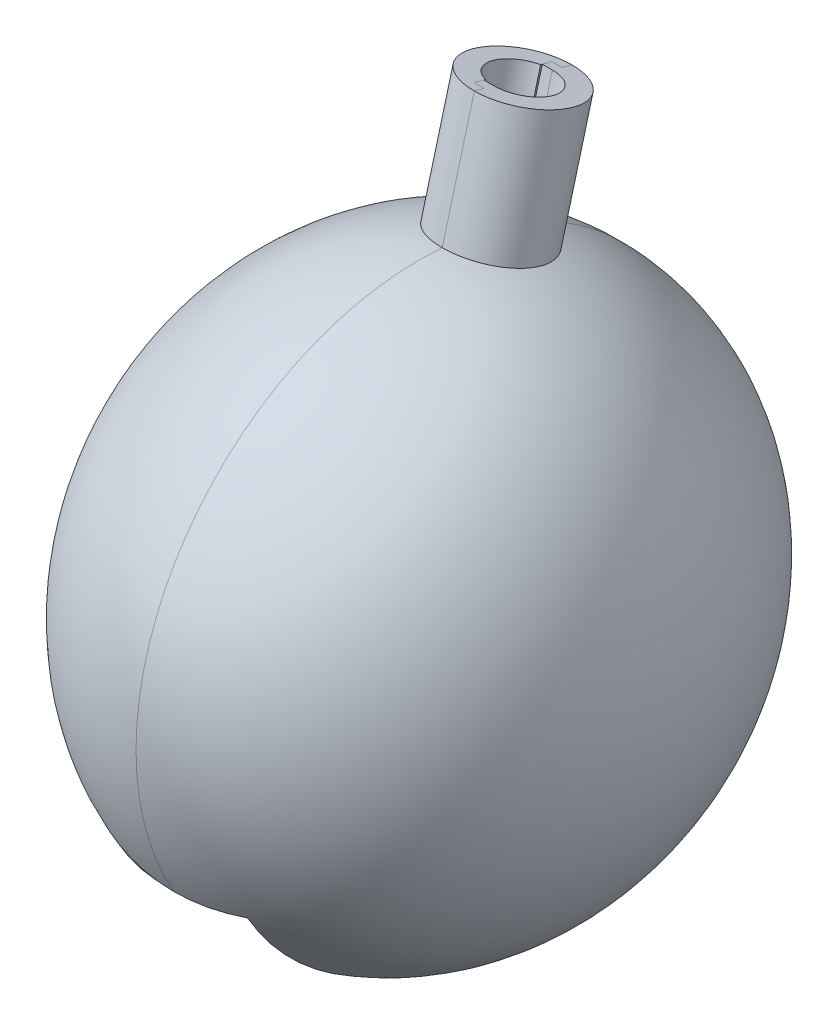
from build123d import *

# Parameters (mm, degrees)
REVOLVE1_ANGLE      = 210
REVOLVE2_ANGLE      = 150
SKETCH5_R           = 4.7625
CUT_EXTRUDE1_DEPTH  = 74.506564505
BOSS_EXTRUDE1_DEPTH = 25.4
SKETCH14_R          = 8.2804
CUT_EXTRUDE2_DEPTH  = 34.036
BOSS_EXTRUDE7_REACH = 101.95
SKETCH15_R          = 6.35
CUT_EXTRUDE3_DEPTH  = 9.525
BOSS_EXTRUDE8_DEPTH = 1.5875
CUT_EXTRUDE5_DEPTH  = 1.5875


with BuildPart() as part:
    # Sketch1 → Revolve1 (revolve)
    with BuildSketch(Plane(origin=(0, 0, 0), x_dir=(1, 0, 0), z_dir=(0, 1, 0))):
        with BuildLine():
            Line((31.75, 0), (38.1, 0))
            add(Edge.make_bspline(
                [(38.1, 0), (38.1, 44.45), (0, 44.45)],
                knots=[4.71238898, 4.71238898, 4.71238898, 6.283185307, 6.283185307, 6.283185307], degree=2, weights=[1, 0.707106781, 1]))
            Line((0, 44.45), (0, 38.1))
            add(Edge.make_bspline(
                [(31.75, 0), (31.75, 38.1), (0, 38.1)],
                knots=[4.71238898, 4.71238898, 4.71238898, 6.283185307, 6.283185307, 6.283185307], degree=2, weights=[1, 0.707106781, 1]))
        make_face()
    revolve(axis=Axis((-31.75, 0, 0), (1, 0, 0)), revolution_arc=REVOLVE1_ANGLE)

    # Sketch2 → Revolve2 (revolve)
    with BuildSketch(Plane.XZ):
        with BuildLine():
            Line((31.75, 0), (38.1, 0))
            add(Edge.make_bspline(
                [(10.16, -42.840413034), (38.1, -33.821378711), (38.1, 0)],
                knots=[0.269932796, 0.269932796, 0.269932796, 1.570796327, 1.570796327, 1.570796327], degree=2, weights=[1, 0.795822426, 1]))
            Line((10.16, -42.840413034), (10.16, -41.252913034))
            Line((10.16, -41.252913034), (12.7, -41.252913034))
            Line((12.7, -41.252913034), (12.7, -37.950913034))
            Line((12.7, -37.950913034), (10.16, -37.950913034))
            Line((10.16, -37.950913034), (10.16, -36.096608373))
            add(Edge.make_bspline(
                [(10.16, -36.096608373), (31.75, -27.345915434), (31.75, 0)],
                knots=[0.325729487, 0.325729487, 0.325729487, 1.570796327, 1.570796327, 1.570796327], degree=2, weights=[1, 0.81240384, 1]))
        make_face()
    revolve(axis=Axis((7.442162916, 0, 0), (-1, 0, 0)), revolution_arc=REVOLVE2_ANGLE)

    # Sketch5 → Cut-Extrude1 (cut, through all)
    with BuildSketch(Plane(origin=(0, 0, 0), x_dir=(1, 0, 0), z_dir=(0, 0.9659258262890681, -0.25881904510252135))):
        Circle(SKETCH5_R)
    extrude(amount=CUT_EXTRUDE1_DEPTH, mode=Mode.SUBTRACT)

    # Sketch6 → Boss-Extrude1 (add)
    with BuildSketch(Plane(origin=(0, 36.513128161, -9.783663204), x_dir=(1, 0, 0), z_dir=(0, 0.9659258262890681, -0.2588190451025213))):
        with BuildLine():
            Line((0, 4.7625), (0, 7.9375))
            ThreePointArc((0, 7.9375), (7.9375, 0), (0, -7.9375))
            Line((0, -7.9375), (0, -4.7625))
            ThreePointArc((0, -4.7625), (4.7625, 0), (0, 4.7625))
        make_face()
    extrude(amount=BOSS_EXTRUDE1_DEPTH)


with BuildPart() as body_2:
    # Mirror1: mirrored copy
    add(part.part.mirror(Plane(origin=(0, 0, 0), x_dir=(0, 0, 1), z_dir=(1, 0, 0))))

    # Sketch14 → Cut-Extrude2 (cut)
    with BuildSketch(Plane(origin=(0, 0, 0), x_dir=(0, 0, -1), z_dir=(1, 0, 0))):
        Circle(SKETCH14_R)
    extrude(amount=-CUT_EXTRUDE2_DEPTH, mode=Mode.SUBTRACT)

    # Sketch18 → Cut-Extrude5 (cut)
    with BuildSketch(Plane(origin=(0, 0, 0), x_dir=(0, 0, -1), z_dir=(1, 0, 0))):
        with BuildLine():
            Line((16.273177356, 36.197808704), (22.491295946, 59.404143212))
            Line((22.491295946, 59.404143212), (10.224037952, 62.691145085))
            Line((10.224037952, 62.691145085), (4.005919362, 39.484810577))
            ThreePointArc((4.005919362, 39.484810577), (-33.323710647, 21.555230571), (-34.370383213, -19.84375))
            Line((-34.370383213, -19.84375), (39.6875, 0))
            ThreePointArc((39.6875, 0), (33.323710647, 21.555230571), (16.273177356, 36.197808704))
        make_face()
    extrude(amount=-CUT_EXTRUDE5_DEPTH, mode=Mode.SUBTRACT)


with BuildPart() as part_1:
    add(part.part)

    # Sketch15 → Boss-Extrude7 (add, up to next)
    with BuildSketch(Plane(origin=(25.4, 0, 0), x_dir=(0, 0, -1), z_dir=(1, 0, 0)), mode=Mode.PRIVATE) as boss_extrude7_sk1:
        Circle(SKETCH15_R)
    boss_extrude7_tool1 = extrude(boss_extrude7_sk1.sketch, amount=BOSS_EXTRUDE7_REACH, mode=Mode.PRIVATE) - part_1.part
    add(boss_extrude7_tool1.solids().sort_by_distance((25.4, 0, 0))[0])

    # Sketch16 → Cut-Extrude3 (cut)
    with BuildSketch(Plane.ZY.offset(-25.4)):
        with BuildLine():
            Line((-1.1176, 1.002193364), (1.1176, 1.002193364))
            ThreePointArc((1.1176, 1.002193364), (0, -1.50114), (-1.1176, 1.002193364))
        make_face()
    extrude(amount=-CUT_EXTRUDE3_DEPTH, mode=Mode.SUBTRACT)

    # Sketch17 → Boss-Extrude8 (add)
    with BuildSketch(Plane.ZY):
        with BuildLine():
            Line((-38.1, 0), (-39.6875, 0))
            ThreePointArc((-39.6875, 0), (-33.323710647, 21.555230571), (-16.273177356, 36.197808704))
            Line((-16.273177356, 36.197808704), (-22.491295946, 59.404143212))
            Line((-22.491295946, 59.404143212), (-20.957888697, 59.815018446))
            Line((-20.957888697, 59.815018446), (-14.383884951, 35.280502458))
            ThreePointArc((-14.383884951, 35.280502458), (-31.61989893, 21.255399118), (-38.1, 0))
        make_face()
        with BuildLine():
            Line((-11.757445202, 62.280269851), (-5.183441456, 37.745753863))
            ThreePointArc((-5.183441456, 37.745753863), (31.61989893, 21.255399118), (32.995567884, -19.05))
            Line((32.995567884, -19.05), (34.370383213, -19.84375))
            ThreePointArc((34.370383213, -19.84375), (33.323710647, 21.555230571), (-4.005919362, 39.484810577))
            Line((-4.005919362, 39.484810577), (-10.224037952, 62.691145085))
            Line((-10.224037952, 62.691145085), (-11.757445202, 62.280269851))
        make_face()
    extrude(amount=BOSS_EXTRUDE8_DEPTH)


solid = Compound([body_2.part, part_1.part])
